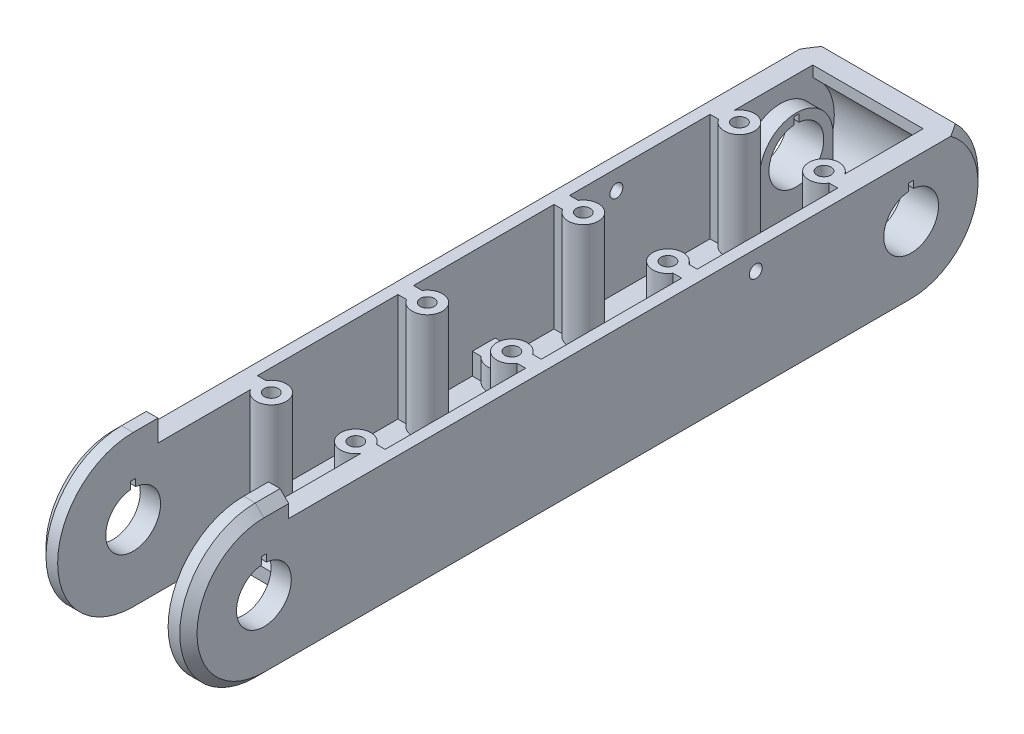
from build123d import *

# Parameters (mm, degrees)
SKETCH1_R           = 6.35
BOSS_EXTRUDE1_DEPTH = 17.5
CUT_EXTRUDE1_DEPTH  = 12.8
CHAMFER1_SIZE       = 2
SKETCH4_R           = 3.5
BOSS_EXTRUDE2_DEPTH = 25
SKETCH8_R           = 1.625
CUT_EXTRUDE4_DEPTH  = 30
SKETCH7_R           = 2.5
CUT_EXTRUDE3_DEPTH  = 3.5
SKETCH9_R           = 4
SKETCH9_R_2         = 1.625
BOSS_EXTRUDE3_DEPTH = 5
SKETCH11_R          = 2.75
CUT_EXTRUDE5_DEPTH  = 3
SKETCH12_R          = 1.625
CUT_EXTRUDE6_DEPTH  = 101.436547133
BOSS_EXTRUDE4_DEPTH = 3.7
SKETCH14_R          = 6.35
CUT_EXTRUDE7_DEPTH  = 3.7
CUT_EXTRUDE8_REACH  = 100.805
SKETCH15_W          = 2
SKETCH15_H          = 32.561115391
SKETCH15_H_2        = 13.634806385
SKETCH16_W          = 2
SKETCH16_H          = 5.291502622
CUT_EXTRUDE9_DEPTH  = 20
CUT_EXTRUDE10_REACH = 102.437
SKETCH17_R          = 1.5
CUT_EXTRUDE11_REACH = 102.437
SKETCH18_W          = 1.2
SKETCH18_H          = 8


with BuildPart() as part:
    # Sketch1 → Boss-Extrude1 (new, symmetric)
    with BuildSketch(Plane(origin=(0, 0, 0), x_dir=(0, 0, -1), z_dir=(1, 0, 0))):
        with BuildLine():
            Line((-75, -17.5), (75, -17.5))
            ThreePointArc((75, -17.5), (91.201851746, -6.614378278), (87.247448714, 12.5))
            Line((87.247448714, 12.5), (-69.247448714, 12.5))
            Line((-69.247448714, 12.5), (-69.247448714, 17.5))
            Line((-69.247448714, 17.5), (-75, 17.5))
            ThreePointArc((-75, 17.5), (-92.5, 0), (-75, -17.5))
        make_face()
        with Locations((-75, 0)):
            Circle(SKETCH1_R, mode=Mode.SUBTRACT)
        with Locations((75, 0)):
            Circle(SKETCH1_R, mode=Mode.SUBTRACT)
    extrude(amount=BOSS_EXTRUDE1_DEPTH, both=True)

    # Sketch3 → Cut-Extrude1 (cut, symmetric)
    with BuildSketch(Plane(origin=(0, 0, 0), x_dir=(0, 0, -1), z_dir=(1, 0, 0))):
        with BuildLine():
            Line((-55, -12.5), (75, -12.5))
            ThreePointArc((75, -12.5), (86.858541226, -3.952847075), (82.5, 10))
            Line((82.5, 10), (82.5, 17.5))
            Line((82.5, 17.5), (-92.5, 17.5))
            Line((-92.5, 17.5), (-92.5, -17.5))
            Line((-92.5, -17.5), (-55, -17.5))
            Line((-55, -17.5), (-55, -12.5))
        make_face()
    extrude(amount=CUT_EXTRUDE1_DEPTH, both=True, mode=Mode.SUBTRACT)

    # Chamfer1
    chamfer1_edges = [part.edges().sort_by_distance(p)[0] for p in [
        (17.5, -6.614378278, -91.201851746),
        (17.5, 17.5, 72.123724357),
        (0, -12.5, 55),
        (17.5, 0, 92.5),
        (-17.5, 17.5, 72.123724357),
        (-17.5, -6.614378278, -91.201851746),
        (-17.5, -17.5, 0),
        (-17.5, 0, 92.5),
        (17.5, -17.5, 0),
    ]]
    chamfer(chamfer1_edges, length=CHAMFER1_SIZE)

    # Sketch4 → Boss-Extrude2 (add)
    with BuildSketch(Plane(origin=(0, -12.5, 0), x_dir=(1, 0, 0), z_dir=(0, 1, 0))):
        with Locations((-9.8, 62.5)):
            Circle(SKETCH4_R)
        with Locations((-9.8, 26.333333333)):
            Circle(SKETCH4_R)
        with Locations((-9.8, -9.833333333)):
            Circle(SKETCH4_R)
        with Locations((-9.8, -46)):
            Circle(SKETCH4_R)
    boss_extrude2 = extrude(amount=BOSS_EXTRUDE2_DEPTH)

    # Sketch8 → Cut-Extrude4 (cut)
    with BuildSketch(Plane(origin=(0, 12.5, 0), x_dir=(1, 0, 0), z_dir=(0, 1, 0))):
        with Locations(Location((-9.8, 62.5, 0), (0, 0, 270))):
            Circle(SKETCH8_R)
        with Locations(Location((-9.8, 26.333333333, 0), (0, 0, 270))):
            Circle(SKETCH8_R)
        with Locations(Location((-9.8, -9.833333333, 0), (0, 0, 270))):
            Circle(SKETCH8_R)
        with Locations(Location((-9.8, -46, 0), (0, 0, 270))):
            Circle(SKETCH8_R)
    cut_extrude4 = extrude(amount=-CUT_EXTRUDE4_DEPTH, mode=Mode.SUBTRACT)

    # Sketch7 → Cut-Extrude3 (cut)
    with BuildSketch(Plane.XZ.offset(17.5)):
        with Locations(Location((-9.8, 46, 0), (0, 0, 270))):
            Circle(SKETCH7_R)
        with Locations(Location((-9.8, 9.833333333, 0), (0, 0, 270))):
            Circle(SKETCH7_R)
        with Locations(Location((-9.8, -26.333333333, 0), (0, 0, 270))):
            Circle(SKETCH7_R)
        with Locations(Location((-9.8, -62.5, 0), (0, 0, 270))):
            Circle(SKETCH7_R)
    cut_extrude3 = extrude(amount=-CUT_EXTRUDE3_DEPTH, mode=Mode.SUBTRACT)

    # Sketch9 → Boss-Extrude3 (add, symmetric)
    with BuildSketch(Plane(origin=(0, -12.5, 0), x_dir=(1, 0, 0), z_dir=(0, 1, 0))):
        with Locations((-9.8, 8.25)):
            Circle(SKETCH9_R)
        with Locations(Location((-9.8, 8.25, 0), (0, 0, 270))):
            Circle(SKETCH9_R_2, mode=Mode.SUBTRACT)
    boss_extrude3 = extrude(amount=BOSS_EXTRUDE3_DEPTH, both=True)

    # Sketch11 → Cut-Extrude5 (cut)
    with BuildSketch(Plane.XZ.offset(17.5)):
        with Locations(Location((-9.8, -8.25, 0), (0, 0, 270))):
            Circle(SKETCH11_R)
    cut_extrude5 = extrude(amount=-CUT_EXTRUDE5_DEPTH, mode=Mode.SUBTRACT)

    # Mirror1: Boss-Extrude2, Cut-Extrude4, Cut-Extrude3, Boss-Extrude3, Cut-Extrude5 across plane
    add(boss_extrude2.mirror(Plane(origin=(0, 0, 0), x_dir=(0, 0, 1), z_dir=(1, 0, 0))))
    add(cut_extrude4.mirror(Plane(origin=(0, 0, 0), x_dir=(0, 0, 1), z_dir=(1, 0, 0))), mode=Mode.SUBTRACT)
    add(cut_extrude3.mirror(Plane(origin=(0, 0, 0), x_dir=(0, 0, 1), z_dir=(1, 0, 0))), mode=Mode.SUBTRACT)
    add(boss_extrude3.mirror(Plane(origin=(0, 0, 0), x_dir=(0, 0, 1), z_dir=(1, 0, 0))))
    add(cut_extrude5.mirror(Plane(origin=(0, 0, 0), x_dir=(0, 0, 1), z_dir=(1, 0, 0))), mode=Mode.SUBTRACT)

    # Sketch12 → Cut-Extrude6 (cut, symmetric)
    with BuildSketch(Plane.XZ.offset(17.5)):
        with Locations(Location((9.8, -8.25, 0), (0, 0, 90))):
            Circle(SKETCH12_R)
    cut_extrude6 = extrude(amount=CUT_EXTRUDE6_DEPTH, both=True, mode=Mode.SUBTRACT)

    # Sketch13 → Boss-Extrude4 (add)
    with BuildSketch(Plane(origin=(-12.8, 0, 0), x_dir=(0, 0, -1), z_dir=(1, 0, 0))):
        with BuildLine():
            Line((66.5, 0), (66.5, -12.5))
            Line((66.5, -12.5), (83.5, -12.5))
            Line((83.5, -12.5), (83.5, 0))
            ThreePointArc((83.5, 0), (75, 8.5), (66.5, 0))
        make_face()
    boss_extrude4 = extrude(amount=BOSS_EXTRUDE4_DEPTH)

    # Sketch14 → Cut-Extrude7 (cut)
    with BuildSketch(Plane.ZY.offset(12.8)):
        with Locations(Location((-75, 0, 0), (0, 0, 180))):
            Circle(SKETCH14_R)
    cut_extrude7 = extrude(amount=-CUT_EXTRUDE7_DEPTH, mode=Mode.SUBTRACT)

    # Cut-Extrude8: up to this face of the body (flat: up to its plane)
    cut_extrude8_end = Plane(part.part.faces().sort_by_distance((0.120666671, -12.5, -10.718703908))[0])
    # Sketch15 → Cut-Extrude8 (cut, up to the picked face)
    with BuildSketch(Plane(origin=(0, 12.5, 0), x_dir=(1, 0, 0), z_dir=(0, 1, 0)), mode=Mode.PRIVATE) as cut_extrude8_sk1:
        with Locations((-13.8, 44.416666667)):
            Rectangle(SKETCH15_W, SKETCH15_H)
    cut_extrude8_tool1 = split(extrude(cut_extrude8_sk1.sketch, amount=-CUT_EXTRUDE8_REACH, mode=Mode.PRIVATE), bisect_by=cut_extrude8_end, keep=Keep.BOTH, mode=Mode.PRIVATE)
    # Sketch15 → Cut-Extrude8 (cut, up to the picked face)
    with BuildSketch(Plane(origin=(0, 12.5, 0), x_dir=(1, 0, 0), z_dir=(0, 1, 0)), mode=Mode.PRIVATE) as cut_extrude8_sk2:
        with Locations((-13.8, 17.713154504)):
            Rectangle(SKETCH15_W, SKETCH15_H_2)
    cut_extrude8_tool2 = split(extrude(cut_extrude8_sk2.sketch, amount=-CUT_EXTRUDE8_REACH, mode=Mode.PRIVATE), bisect_by=cut_extrude8_end, keep=Keep.BOTH, mode=Mode.PRIVATE)
    # Sketch15 → Cut-Extrude8 (cut, up to the picked face)
    with BuildSketch(Plane(origin=(0, 12.5, 0), x_dir=(1, 0, 0), z_dir=(0, 1, 0)), mode=Mode.PRIVATE) as cut_extrude8_sk3:
        with Locations((-13.8, -1.213154504)):
            Rectangle(SKETCH15_W, SKETCH15_H_2)
    cut_extrude8_tool3 = split(extrude(cut_extrude8_sk3.sketch, amount=-CUT_EXTRUDE8_REACH, mode=Mode.PRIVATE), bisect_by=cut_extrude8_end, keep=Keep.BOTH, mode=Mode.PRIVATE)
    # Sketch15 → Cut-Extrude8 (cut, up to the picked face)
    with BuildSketch(Plane(origin=(0, 12.5, 0), x_dir=(1, 0, 0), z_dir=(0, 1, 0)), mode=Mode.PRIVATE) as cut_extrude8_sk4:
        with Locations((-13.8, -27.916666666)):
            Rectangle(SKETCH15_W, SKETCH15_H)
    cut_extrude8_tool4 = split(extrude(cut_extrude8_sk4.sketch, amount=-CUT_EXTRUDE8_REACH, mode=Mode.PRIVATE), bisect_by=cut_extrude8_end, keep=Keep.BOTH, mode=Mode.PRIVATE)
    cut_extrude8_1 = cut_extrude8_tool1.solids().sort_by(Axis((-13.8, 12.5, -44.416667), (0, -1, 0)))[0]
    add(cut_extrude8_1, mode=Mode.SUBTRACT)
    cut_extrude8_2 = cut_extrude8_tool2.solids().sort_by(Axis((-13.8, 12.5, -17.713155), (0, -1, 0)))[0]
    add(cut_extrude8_2, mode=Mode.SUBTRACT)
    cut_extrude8_3 = cut_extrude8_tool3.solids().sort_by(Axis((-13.8, 12.5, 1.213155), (0, -1, 0)))[0]
    add(cut_extrude8_3, mode=Mode.SUBTRACT)
    cut_extrude8_4 = cut_extrude8_tool4.solids().sort_by(Axis((-13.8, 12.5, 27.916667), (0, -1, 0)))[0]
    add(cut_extrude8_4, mode=Mode.SUBTRACT)
    cut_extrude8 = cut_extrude8_1 + cut_extrude8_2 + cut_extrude8_3 + cut_extrude8_4  # Cut-Extrude8 as one shape, for the pattern or mirror that repeats it

    # Sketch16 → Cut-Extrude9 (cut)
    with BuildSketch(Plane(origin=(0, 12.5, 0), x_dir=(1, 0, 0), z_dir=(0, 1, 0))):
        with Locations((-13.8, 8.25)):
            Rectangle(SKETCH16_W, SKETCH16_H)
    cut_extrude9 = extrude(amount=-CUT_EXTRUDE9_DEPTH, mode=Mode.SUBTRACT)

    # Mirror2: Cut-Extrude6, Boss-Extrude4, Cut-Extrude7, Cut-Extrude8, Cut-Extrude9 across plane
    add(cut_extrude6.mirror(Plane(origin=(0, 0, 0), x_dir=(0, 0, 1), z_dir=(1, 0, 0))), mode=Mode.SUBTRACT)
    add(boss_extrude4.mirror(Plane(origin=(0, 0, 0), x_dir=(0, 0, 1), z_dir=(1, 0, 0))))
    add(cut_extrude7.mirror(Plane(origin=(0, 0, 0), x_dir=(0, 0, 1), z_dir=(1, 0, 0))), mode=Mode.SUBTRACT)
    add(cut_extrude8.mirror(Plane(origin=(0, 0, 0), x_dir=(0, 0, 1), z_dir=(1, 0, 0))), mode=Mode.SUBTRACT)
    add(cut_extrude9.mirror(Plane(origin=(0, 0, 0), x_dir=(0, 0, 1), z_dir=(1, 0, 0))), mode=Mode.SUBTRACT)

    # Cut-Extrude10: up to this face of the body (flat: up to its plane)
    cut_extrude10_end = Plane(part.part.faces().sort_by_distance((-17.5, -1.343633732, 0.577395586))[0])
    # Sketch17 → Cut-Extrude10 (cut, up to the picked face)
    with BuildSketch(Plane(origin=(17.5, 0, 0), x_dir=(0, 0, -1), z_dir=(1, 0, 0)), mode=Mode.PRIVATE) as cut_extrude10_sk1:
        with Locations((39, 8)):
            Circle(SKETCH17_R)
    cut_extrude10_tool1 = split(extrude(cut_extrude10_sk1.sketch, amount=-CUT_EXTRUDE10_REACH, mode=Mode.PRIVATE), bisect_by=cut_extrude10_end, keep=Keep.BOTH, mode=Mode.PRIVATE)
    add(cut_extrude10_tool1.solids().sort_by(Axis((17.5, 8, -39), (-1, 0, 0)))[0], mode=Mode.SUBTRACT)

    # Cut-Extrude11: up to this face of the body (flat: up to its plane)
    cut_extrude11_end = Plane(part.part.faces().sort_by_distance((17.5, -1.35770743, 0.637008401))[0])
    # Sketch18 → Cut-Extrude11 (cut, up to the picked face)
    with BuildSketch(Plane.ZY.offset(17.5), mode=Mode.PRIVATE) as cut_extrude11_sk1:
        with Locations((-75, 4)):
            Rectangle(SKETCH18_W, SKETCH18_H)
    cut_extrude11_tool1 = split(extrude(cut_extrude11_sk1.sketch, amount=-CUT_EXTRUDE11_REACH, mode=Mode.PRIVATE), bisect_by=cut_extrude11_end, keep=Keep.BOTH, mode=Mode.PRIVATE)
    cut_extrude11 = cut_extrude11_tool1.solids().sort_by(Axis((-17.5, 4, -75), (1, 0, 0)))[0]
    add(cut_extrude11, mode=Mode.SUBTRACT)

    # Mirror3: Cut-Extrude11 across plane
    add(cut_extrude11.mirror(Plane.XY), mode=Mode.SUBTRACT)


solid = part.part
